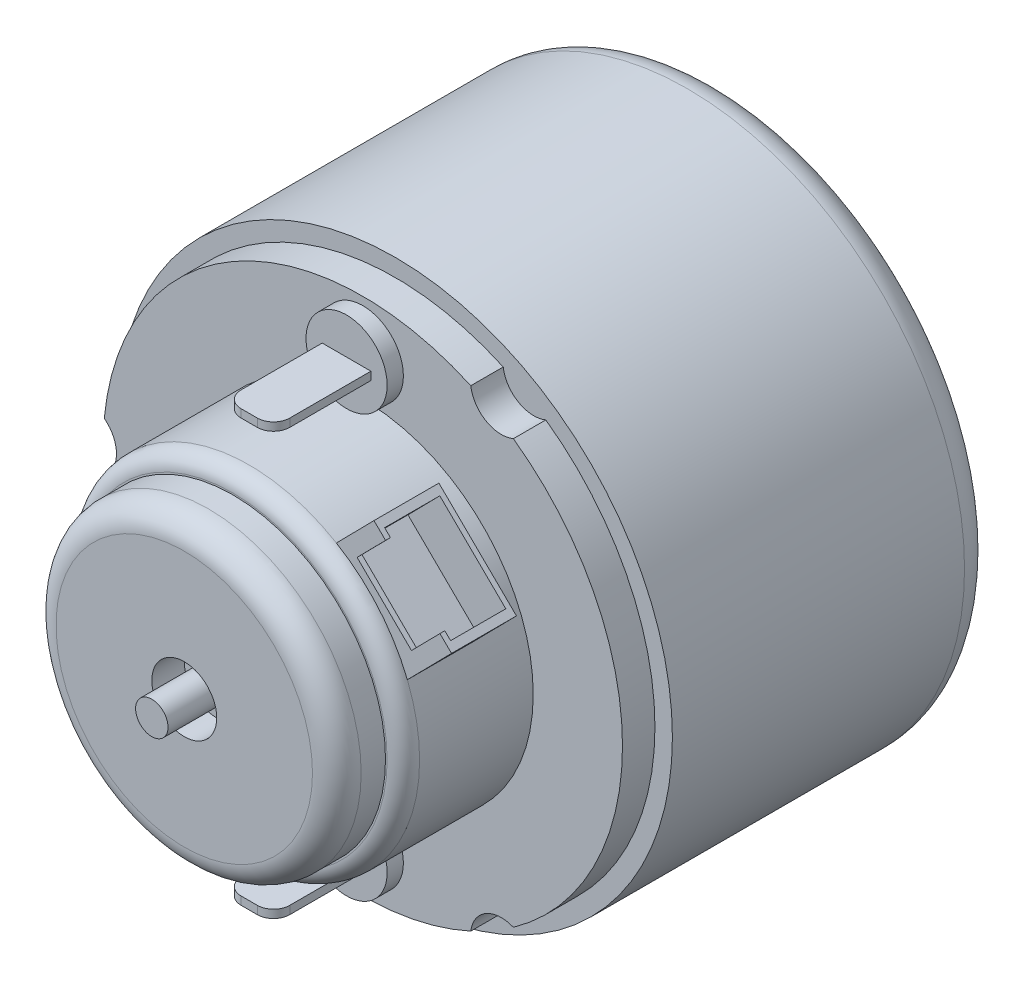
from build123d import *

# Parameters (mm, degrees)
ESBO_O1_R                                  = 17.075
RESSALTO_EXTRUS_O1_DEPTH                   = 20
ESBO_O4_R                                  = 3.5
RESSALTO_EXTRUS_O4_DEPTH                   = 1.5
ESBO_O14_R                                 = 1
RESSALTO_EXTRUS_O7_DEPTH                   = 3.5
FURO_ROSCADO_DE_M2_5X0_451_D               = 2.05
FURO_ROSCADO_DE_M2_5X0_451_DEPTH           = 3.5
FURO_ROSCADO_DE_M2_5X0_451_TIP             = 0.615882135
FILETE1_R                                  = 2
RESSALTO_EXTRUS_O9_DEPTH                   = 2
ESBO_O18_R                                 = 10.5
RESSALTO_EXTRUS_O10_DEPTH                  = 8
FILETE2_R                                  = 1
ESBO_O19_R                                 = 9.4
RESSALTO_EXTRUS_O11_DEPTH                  = 3
FILETE3_R                                  = 1.5
ESBO_O20_R                                 = 2
CORTE_EXTRUS_O1_DEPTH                      = 2
RESSALTO_EXTRUS_O13_START                  = 4
ESBO_O21_R                                 = 1
RESSALTO_EXTRUS_O13_DEPTH                  = 4
ESBO_O22_R                                 = 2.5
RESSALTO_EXTRUS_O15_DEPTH                  = 1
RESSALTO_EXTRUS_O15_2_DEPTH                = 1
ESBO_O23_W                                 = 3
ESBO_O23_H                                 = 0.5
RESSALTO_EXTRUS_O16_DEPTH                  = 6
FILETE4_R                                  = 1
FILETE5_R                                  = 1
ESBO_O24_W                                 = 6.7
ESBO_O24_H                                 = 4
RESSALTO_EXTRUS_O17_DEPTH                  = 3
RESSALTO_EXTRUS_O17_DIRECTION_2_REACH      = 51.249
RESSALTO_EXTRUS_O17_DIRECTION_2_END_RADIUS = 10.5
ESBO_O25_W                                 = 5.7
ESBO_O25_H                                 = 3
ESBO_O25_H_2                               = 0.2
CORTE_EXTRUS_O2_DEPTH                      = 2.8
ESBO_O26_W                                 = 4.7
ESBO_O26_H                                 = 0.3
CORTE_EXTRUS_O3_DEPTH                      = 2.5


with BuildPart() as part:
    # Esboço1 → Ressalto-extrusão1 (new body)
    with BuildSketch(Plane.XY):
        Circle(ESBO_O1_R)
    extrude(amount=RESSALTO_EXTRUS_O1_DEPTH)

    # Esboço4 → Ressalto-extrusão4 (add)
    with BuildSketch(Plane(origin=(0, 0, 0), x_dir=(-1, 0, 0), z_dir=(0, 0, -1))):
        with Locations(Location((0, 0, 0), (0, 0, 180))):
            Circle(ESBO_O4_R)
    extrude(amount=RESSALTO_EXTRUS_O4_DEPTH)

    # Esboço14 → Ressalto-extrusão7 (add)
    with BuildSketch(Plane(origin=(0, 0, -1.5), x_dir=(-1, 0, 0), z_dir=(0, 0, -1))):
        Circle(ESBO_O14_R)
    extrude(amount=RESSALTO_EXTRUS_O7_DEPTH)

    # Furo roscado de M2.5x0.451
    with Locations(Plane(origin=(0, 0, 0), x_dir=(-1, 0, 0), z_dir=(0, 0, -1))):
        with Locations((11.258330249, -6.5), (0, 13), (-11.258330249, -6.5), (11.258330249, 6.5), (0, -13), (-11.258330249, 6.5)):
            Hole(FURO_ROSCADO_DE_M2_5X0_451_D / 2, depth=FURO_ROSCADO_DE_M2_5X0_451_DEPTH)
            with Locations((0, 0, -(FURO_ROSCADO_DE_M2_5X0_451_DEPTH + FURO_ROSCADO_DE_M2_5X0_451_TIP / 2))):  # 118° drill point
                Cone(0, FURO_ROSCADO_DE_M2_5X0_451_D / 2, FURO_ROSCADO_DE_M2_5X0_451_TIP, mode=Mode.SUBTRACT)

    # Filete1
    filete1_edges = [part.edges().sort_by_distance(p)[0] for p in [
        (-17.075, 0, 0),
    ]]
    fillet(filete1_edges, radius=FILETE1_R)

    # Esboço17 → Ressalto-extrusão9 (add)
    with BuildSketch(Plane.XY.offset(20)):
        with BuildLine():
            ThreePointArc((6.652189728, -14.551576266), (7.5875, -13.141935502), (9.275939847, -13.036753428))
            ThreePointArc((9.275939847, -13.036753428), (16, 0), (9.275939847, 13.036753428))
            ThreePointArc((9.275939847, 13.036753428), (7.5875, 13.141935502), (6.652189728, 14.551576266))
            ThreePointArc((6.652189728, 14.551576266), (-8, 13.856406461), (-15.928129575, 1.514822838))
            ThreePointArc((-15.928129575, 1.514822838), (-15.175, 0), (-15.928129575, -1.514822838))
            ThreePointArc((-15.928129575, -1.514822838), (-8, -13.856406461), (6.652189728, -14.551576266))
        make_face()
    extrude(amount=RESSALTO_EXTRUS_O9_DEPTH)

    # Esboço18 → Ressalto-extrusão10 (add)
    with BuildSketch(Plane.XY.offset(22)):
        Circle(ESBO_O18_R)
    extrude(amount=RESSALTO_EXTRUS_O10_DEPTH)

    # Filete2
    filete2_edges = [part.edges().sort_by_distance(p)[0] for p in [
        (-10.5, 0, 30),
    ]]
    fillet(filete2_edges, radius=FILETE2_R)

    # Esboço19 → Ressalto-extrusão11 (add)
    with BuildSketch(Plane.XY.offset(30)):
        Circle(ESBO_O19_R)
    extrude(amount=RESSALTO_EXTRUS_O11_DEPTH)

    # Filete3
    filete3_edges = [part.edges().sort_by_distance(p)[0] for p in [
        (-9.4, 0, 33),
    ]]
    fillet(filete3_edges, radius=FILETE3_R)

    # Esboço20 → Corte-extrusão1 (cut)
    with BuildSketch(Plane.XY.offset(33)):
        Circle(ESBO_O20_R)
    extrude(amount=-CORTE_EXTRUS_O1_DEPTH, mode=Mode.SUBTRACT)

    # Esboço21 → Ressalto-extrusão13 (add)
    with BuildSketch(Plane.XY.offset(31).offset(RESSALTO_EXTRUS_O13_START)):
        with Locations(Location((0, 0, 0), (0, 0, 180))):
            Circle(ESBO_O21_R)
    extrude(amount=-RESSALTO_EXTRUS_O13_DEPTH)

    # Esboço24 → Ressalto-extrusão17 (add)
    with BuildSketch(Plane(origin=(7.361307949, 7.4873991, 0), x_dir=(-0.7130856285858408, 0.7010769474917403, 0), z_dir=(0.7010769474917403, 0.7130856285858408, 0))):
        with Locations((-0.859017769, 27)):
            Rectangle(ESBO_O24_W, ESBO_O24_H)
    extrude(amount=RESSALTO_EXTRUS_O17_DEPTH)

    # Ressalto-extrusão17 direction 2: up to this cylinder (the profile starts outside it)
    ressalto_extrus_o17_direction_2_end = Plane(origin=(0, 0, 27), z_dir=(0, 0, -1)) * Cylinder(RESSALTO_EXTRUS_O17_DIRECTION_2_END_RADIUS, 124.498, mode=Mode.PRIVATE)
    # Esboço24 → Ressalto-extrusão17 direction 2 (add, up to the surface)
    with BuildSketch(Plane(origin=(7.361307949, 7.4873991, 0), x_dir=(-0.7130856285858408, 0.7010769474917403, 0), z_dir=(0.7010769474917403, 0.7130856285858408, 0)), mode=Mode.PRIVATE) as ressalto_extrus_o17_direction_2_sk1:
        with Locations((-0.859017769, 27)):
            Rectangle(ESBO_O24_W, ESBO_O24_H)
    ressalto_extrus_o17_direction_2_tool1 = extrude(ressalto_extrus_o17_direction_2_sk1.sketch, amount=-RESSALTO_EXTRUS_O17_DIRECTION_2_REACH, mode=Mode.PRIVATE) - ressalto_extrus_o17_direction_2_end
    add(ressalto_extrus_o17_direction_2_tool1.solids().sort_by_distance((7.973861, 6.885162, 27))[0])
    add(ressalto_extrus_o17_direction_2_tool1.solids().sort_by_distance((7.973861, 6.885162, 27))[1])

    # Esboço25 → Corte-extrusão2 (cut)
    with BuildSketch(Plane(origin=(9.464538791, 9.626655986, 0), x_dir=(0.7130856285858407, -0.7010769474917404, 0), z_dir=(0.7010769474917404, 0.7130856285858407, 0))):
        with Locations((0.859017769, -27)):
            Rectangle(ESBO_O25_W, ESBO_O25_H)
        with Locations((0.859017769, -28.6)):
            Rectangle(ESBO_O25_W, ESBO_O25_H_2)
        with Locations((0.859017769, -25.4)):
            Rectangle(ESBO_O25_W, ESBO_O25_H_2)
    extrude(amount=-CORTE_EXTRUS_O2_DEPTH, mode=Mode.SUBTRACT)

    # Esboço26 → Corte-extrusão3 (cut)
    with BuildSketch(Plane(origin=(9.464538791, 9.626655986, 0), x_dir=(0.7130856285858407, -0.7010769474917404, 0), z_dir=(0.7010769474917404, 0.7130856285858407, 0))):
        with Locations((0.859017769, -28.85)):
            Rectangle(ESBO_O26_W, ESBO_O26_H)
    extrude(amount=-CORTE_EXTRUS_O3_DEPTH, mode=Mode.SUBTRACT)


with BuildPart() as body_2:
    # Esboço22 → Ressalto-extrusão15 (new body)
    with BuildSketch(Plane.XY.offset(22)):
        with Locations((0, 13)):
            Circle(ESBO_O22_R)
    extrude(amount=RESSALTO_EXTRUS_O15_DEPTH)



with BuildPart() as body_3:
    # Esboço22 → Ressalto-extrus_o15 2 (new body)
    with BuildSketch(Plane.XY.offset(22)):
        with Locations((0, -13)):
            Circle(ESBO_O22_R)
    extrude(amount=RESSALTO_EXTRUS_O15_2_DEPTH)


with BuildPart() as body_2_1:
    add(body_2.part)

    add(body_3.part)  # Ressalto-extrusão16 merges body 3
    # Esboço23 → Ressalto-extrusão16 (add)
    with BuildSketch(Plane.XY.offset(23)):
        with Locations((0, -13)):
            Rectangle(ESBO_O23_W, ESBO_O23_H)
        with Locations((0, 13)):
            Rectangle(ESBO_O23_W, ESBO_O23_H)
    extrude(amount=RESSALTO_EXTRUS_O16_DEPTH)

    # Filete4
    filete4_edges = [body_2_1.edges().sort_by_distance(p)[0] for p in [
        (-1.5, -13, 29),
        (1.5, -13, 29),
    ]]
    fillet(filete4_edges, radius=FILETE4_R)

    # Filete5
    filete5_edges = [body_2_1.edges().sort_by_distance(p)[0] for p in [
        (-1.5, 13, 29),
        (1.5, 13, 29),
    ]]
    fillet(filete5_edges, radius=FILETE5_R)


solid = Compound([part.part, body_2_1.part])
